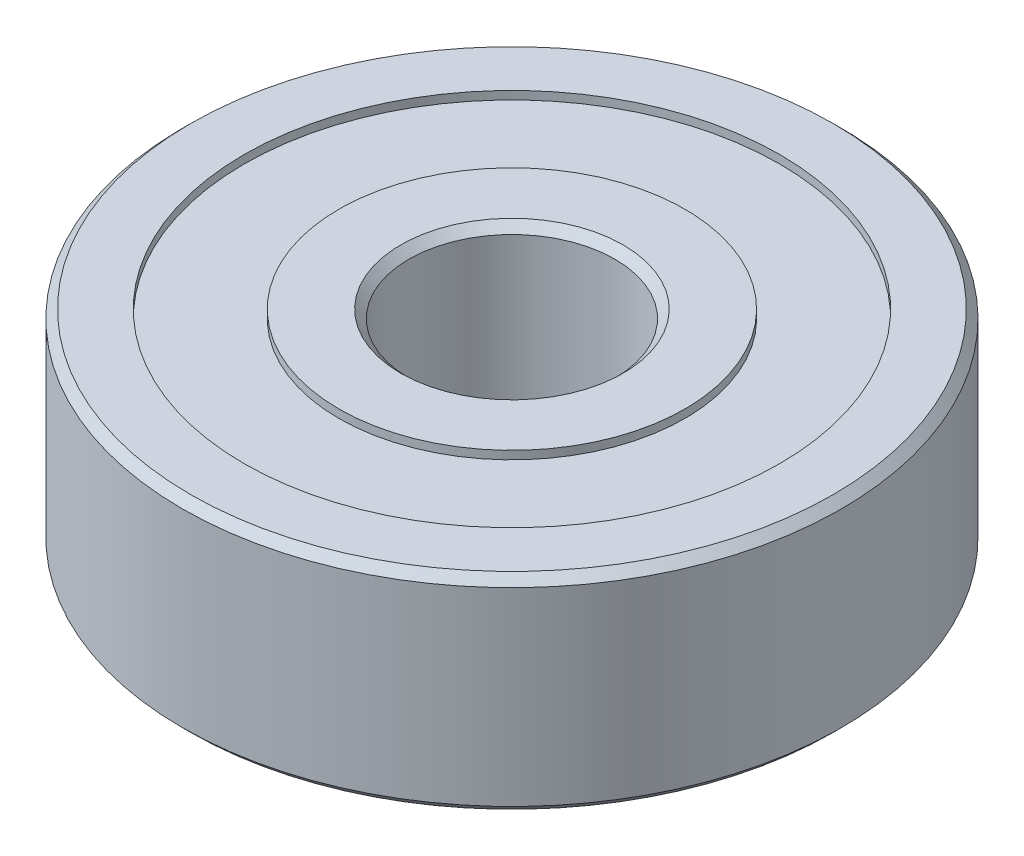
from build123d import *

# Parameters (mm, degrees)
SKETCH1_R           = 8
SKETCH1_R_2         = 2.5
BOSS_EXTRUDE1_DEPTH = 5
SKETCH2_R           = 6.5
SKETCH2_R_2         = 4.2
CUT_EXTRUDE1_DEPTH  = 0.2
CUT_EXTRUDE2_START  = -0.2
SKETCH3_R           = 6.5
SKETCH3_R_2         = 4.2
CUT_EXTRUDE2_DEPTH  = 0.2
CHAMFER1_SIZE       = 0.2


with BuildPart() as part:
    # Sketch1 → Boss-Extrude1 (new body)
    with BuildSketch(Plane(origin=(0, 0, 0), x_dir=(1, 0, 0), z_dir=(0, 1, 0))):
        with Locations(Location((0, 0, 0), (0, 0, 270))):
            Circle(SKETCH1_R)
        with Locations(Location((0, 0, 0), (0, 0, 270))):
            Circle(SKETCH1_R_2, mode=Mode.SUBTRACT)
    extrude(amount=BOSS_EXTRUDE1_DEPTH)

    # Sketch2 → Cut-Extrude1 (cut)
    with BuildSketch(Plane(origin=(0, 5, 0), x_dir=(1, 0, 0), z_dir=(0, 1, 0))):
        with Locations(Location((0, 0, 0), (0, 0, 270))):
            Circle(SKETCH2_R)
        with Locations(Location((0, 0, 0), (0, 0, 270))):
            Circle(SKETCH2_R_2, mode=Mode.SUBTRACT)
    extrude(amount=-CUT_EXTRUDE1_DEPTH, mode=Mode.SUBTRACT)

    # Sketch3 → Cut-Extrude2 (cut)
    with BuildSketch(Plane.XZ.offset(CUT_EXTRUDE2_START)):
        with Locations(Location((0, 0, 0), (0, 0, 90))):
            Circle(SKETCH3_R)
        with Locations(Location((0, 0, 0), (0, 0, 90))):
            Circle(SKETCH3_R_2, mode=Mode.SUBTRACT)
    extrude(amount=CUT_EXTRUDE2_DEPTH, mode=Mode.SUBTRACT)

    # Chamfer1
    chamfer1_edges = [part.edges().sort_by_distance(p)[0] for p in [
        (0, 0, -8),
        (0, 5, -8),
        (0, 0, -2.5),
        (0, 5, -2.5),
    ]]
    chamfer(chamfer1_edges, length=CHAMFER1_SIZE)


solid = part.part
